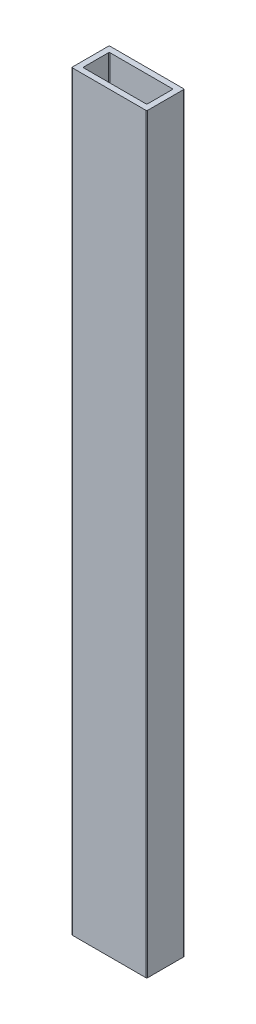
from build123d import *

# Parameters (mm, degrees)
SKETCH_1_W      = 20
SKETCH_1_H      = 10
SKETCH_1_W_2    = 17
SKETCH_1_H_2    = 7
EXTRUDE_1_DEPTH = 200
FILLET_1_R      = 0.2


with BuildPart() as part:
    # Эскиз1 → Бобышка-Вытянуть1 (new body)
    with BuildSketch(Plane(origin=(0, 0, 0), x_dir=(1, 0, 0), z_dir=(0, 1, 0))):
        Rectangle(SKETCH_1_W, SKETCH_1_H)
        Rectangle(SKETCH_1_W_2, SKETCH_1_H_2, mode=Mode.SUBTRACT)
    extrude(amount=EXTRUDE_1_DEPTH)

    # Скругление1
    fillet_1_edges = [part.edges().sort_by_distance(p)[0] for p in [
        (8.5, 100, 3.5),
        (8.5, 100, -3.5),
        (-8.5, 100, -3.5),
        (-8.5, 100, 3.5),
        (-10, 100, -5),
        (10, 100, -5),
        (10, 100, 5),
        (-10, 100, 5),
    ]]
    fillet(fillet_1_edges, radius=FILLET_1_R)


solid = part.part
